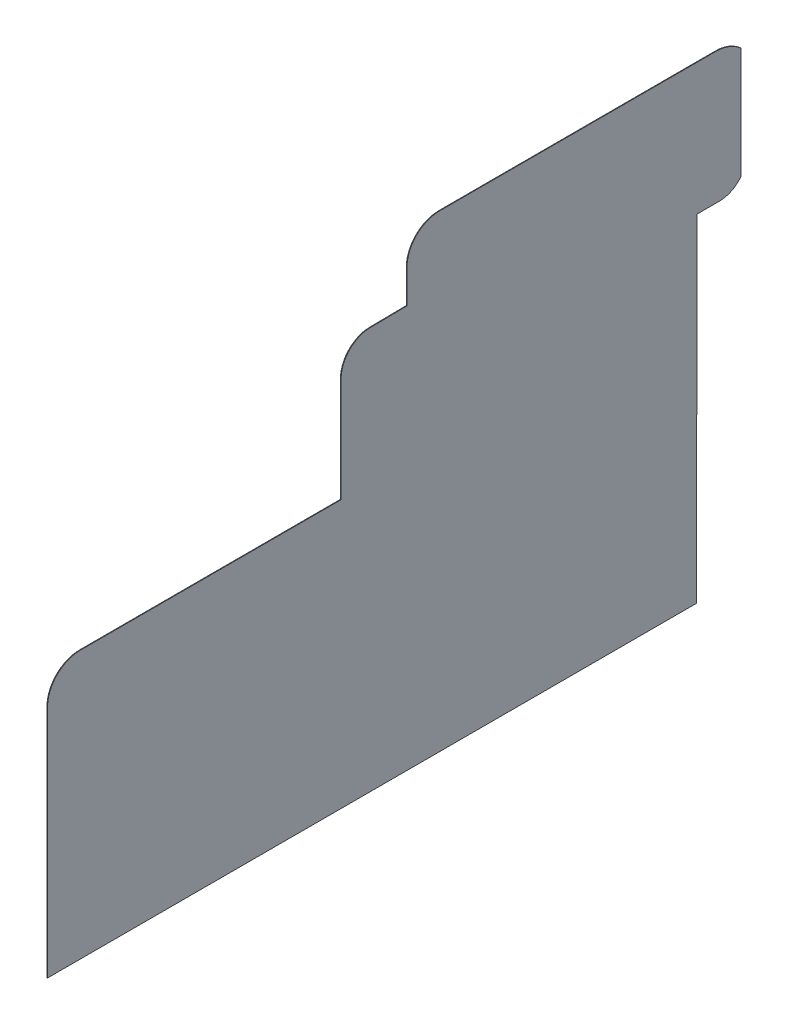
from build123d import *

# Parameters (mm, degrees)
ESTRUSIONE_ESTRUSIONE1_DEPTH = 0.001


with BuildPart() as part:
    # Schizzo1 → Estrusione-Estrusione1 (new body)
    with BuildSketch(Plane(origin=(0, 0, 0), x_dir=(0, 0, -1), z_dir=(1, 0, 0))):
        with BuildLine():
            Line((-1.120450557, 0.016083045), (-1.120450557, 0.395388309))
            ThreePointArc((-1.120450557, 0.395388309), (-1.104963, 0.43277858), (-1.067572729, 0.448266137))
            Line((-1.067572729, 0.448266137), (-0.646200691, 0.448266137))
            Line((-0.646200691, 0.448266137), (-0.646200691, 0.61756545))
            ThreePointArc((-0.646200691, 0.61756545), (-0.632365719, 0.651249323), (-0.598848989, 0.665484439))
            Line((-0.598848989, 0.665484439), (-0.539752847, 0.666188238))
            Line((-0.539752847, 0.666188238), (-0.539752847, 0.720206582))
            ThreePointArc((-0.539752847, 0.720206582), (-0.524370528, 0.757342786), (-0.487234324, 0.772725105))
            Line((-0.487234324, 0.772725105), (-0.041067153, 0.772725105))
            ThreePointArc((-0.041067153, 0.772725105), (-0.019048902, 0.768612289), (0, 0.756828487))
            Line((0, 0.756828487), (0, 0.577556624))
            ThreePointArc((0, 0.577556624), (-0.015549033, 0.564779444), (-0.035147663, 0.56020534))
            Line((-0.035147663, 0.56020534), (-0.071222104, 0.56020534))
            Line((-0.071222104, 0.56020534), (-0.071962073, 0.016083045))
            Line((-0.071962073, 0.016083045), (-1.120450557, 0.016083045))
        make_face()
    extrude(amount=ESTRUSIONE_ESTRUSIONE1_DEPTH)


solid = part.part
